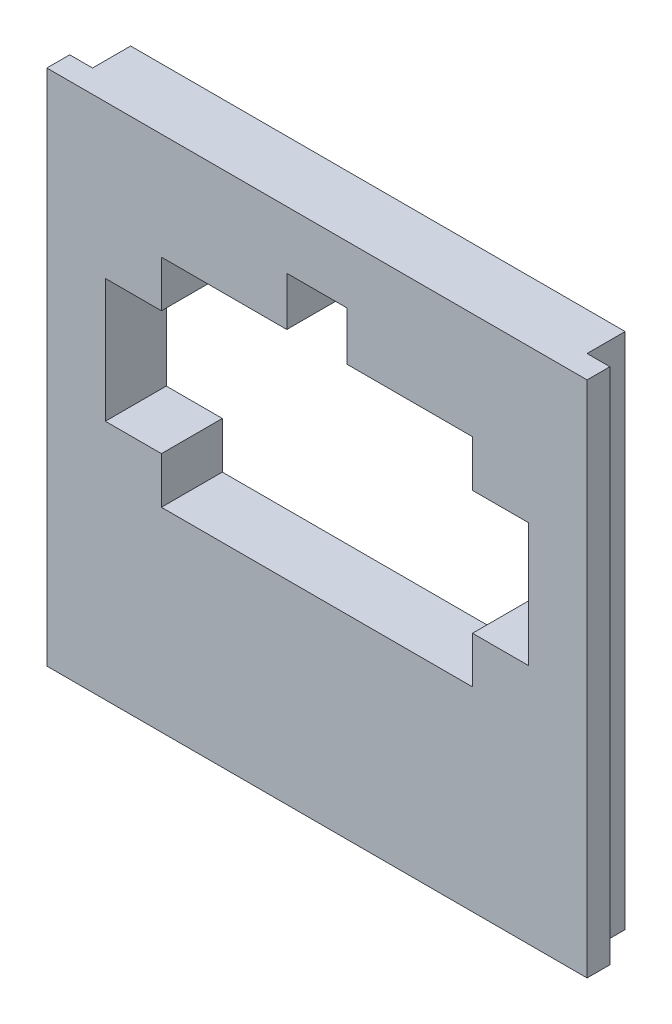
from build123d import *

# Parameters (mm, degrees)
SKETCH1_W           = 16.23
SKETCH1_H           = 17
BOSS_EXTRUDE1_DEPTH = 2
SKETCH2_W           = 0.749
SKETCH2_H           = 17
BOSS_EXTRUDE2_DEPTH = 0.75
SKETCH3_W           = 0.75
SKETCH3_H           = 17
BOSS_EXTRUDE4_DEPTH = 0.75
CUT_EXTRUDE1_DEPTH  = 16.776621323
CUT_EXTRUDE3_DEPTH  = 0.5


with BuildPart() as part:
    # Sketch1 → Boss-Extrude1 (new body)
    with BuildSketch(Plane.XY):
        with Locations((2.412127937, -2.350261097)):
            Rectangle(SKETCH1_W, SKETCH1_H)
    extrude(amount=BOSS_EXTRUDE1_DEPTH)

    # Sketch2 → Boss-Extrude2 (add)
    with BuildSketch(Plane(origin=(10.527127937, 0, 0), x_dir=(0, 0, -1), z_dir=(1, 0, 0))):
        with Locations((-1.6255, -2.350261097)):
            Rectangle(SKETCH2_W, SKETCH2_H)
    extrude(amount=BOSS_EXTRUDE2_DEPTH)

    # Sketch3 → Boss-Extrude4 (add)
    with BuildSketch(Plane.ZY.offset(5.702872063)):
        with Locations((1.625, -2.350261097)):
            Rectangle(SKETCH3_W, SKETCH3_H)
    extrude(amount=BOSS_EXTRUDE4_DEPTH)

    # Sketch4 → Cut-Extrude1 (cut, through all)
    with BuildSketch(Plane(origin=(0, 0, 0), x_dir=(-1, 0, 0), z_dir=(0, 0, -1))):
        Polygon((-7.517127937, 2.653975471), (-3.402127937, 2.653975471), (-3.402127937, 4.253975471), (-1.422127937, 4.253975471), (-1.422127937, 2.653975471), (2.692872063, 2.653975471), (2.692872063, 1.128975471), (4.532872063, 1.128975471), (4.532872063, -2.931024529), (2.692872063, -2.931024529), (2.692872063, -4.456024529), (-7.517127937, -4.456024529), (-7.517127937, -2.931024529), (-9.357127937, -2.931024529), (-9.357127937, 1.128975471), (-7.517127937, 1.128975471), align=None)
    extrude(amount=-CUT_EXTRUDE1_DEPTH, mode=Mode.SUBTRACT)

    # Sketch6 → Cut-Extrude3 (cut)
    with BuildSketch(Plane(origin=(0, 0, 0), x_dir=(-1, 0, 0), z_dir=(0, 0, -1))):
        with BuildLine():
            Line((-5.412127937, -10.850261097), (0.587872063, -10.850261097))
            ThreePointArc((0.587872063, -10.850261097), (-2.412127937, -7.850261097), (-5.412127937, -10.850261097))
        make_face()
    extrude(amount=-CUT_EXTRUDE3_DEPTH, mode=Mode.SUBTRACT)


solid = part.part
